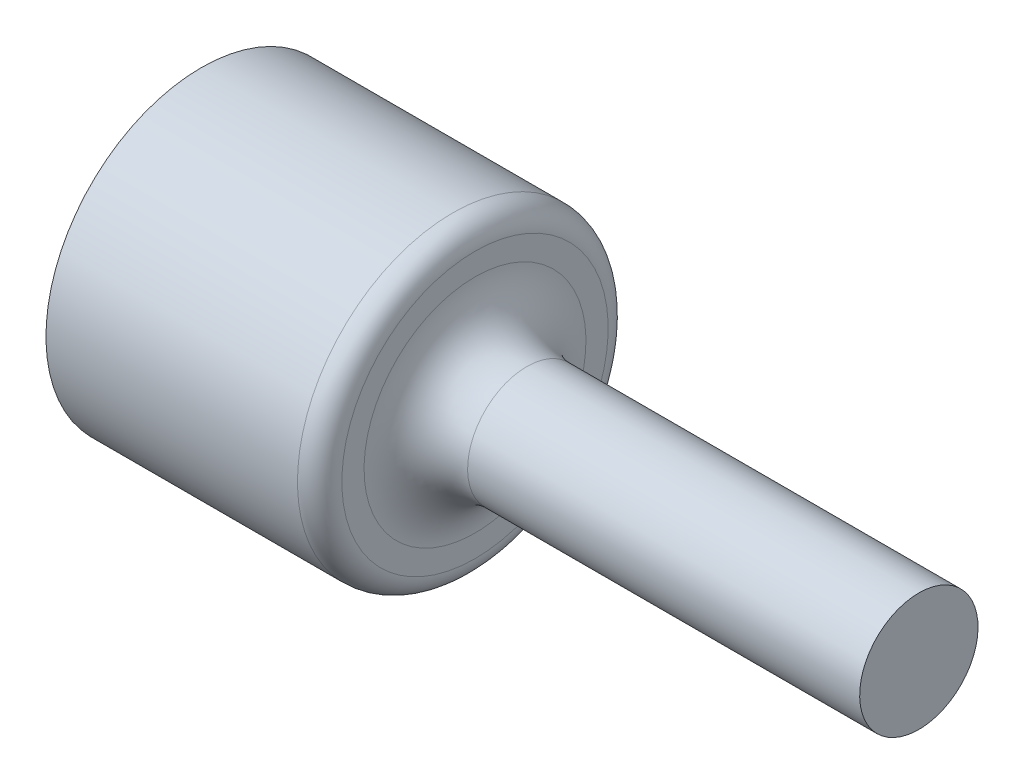
from build123d import *

# Parameters (mm, degrees)
FILLET1_R = 3
FILLET2_R = 7


with BuildPart() as part:
    # Sketch1 → Revolve1 (revolve)
    with BuildSketch(Plane.XY):
        Polygon((0, 0), (0, 21), (37, 21), (37, 8), (97, 8), (97, 0), align=None)
    revolve(axis=Axis((97, 0, 0), (-1, 0, 0)))

    # Fillet1
    fillet1_edges = [part.edges().sort_by_distance(p)[0] for p in [
        (37, -21, 0),
    ]]
    fillet(fillet1_edges, radius=FILLET1_R)

    # Fillet2
    fillet2_edges = [part.edges().sort_by_distance(p)[0] for p in [
        (37, -8, 0),
    ]]
    fillet(fillet2_edges, radius=FILLET2_R)


solid = part.part
